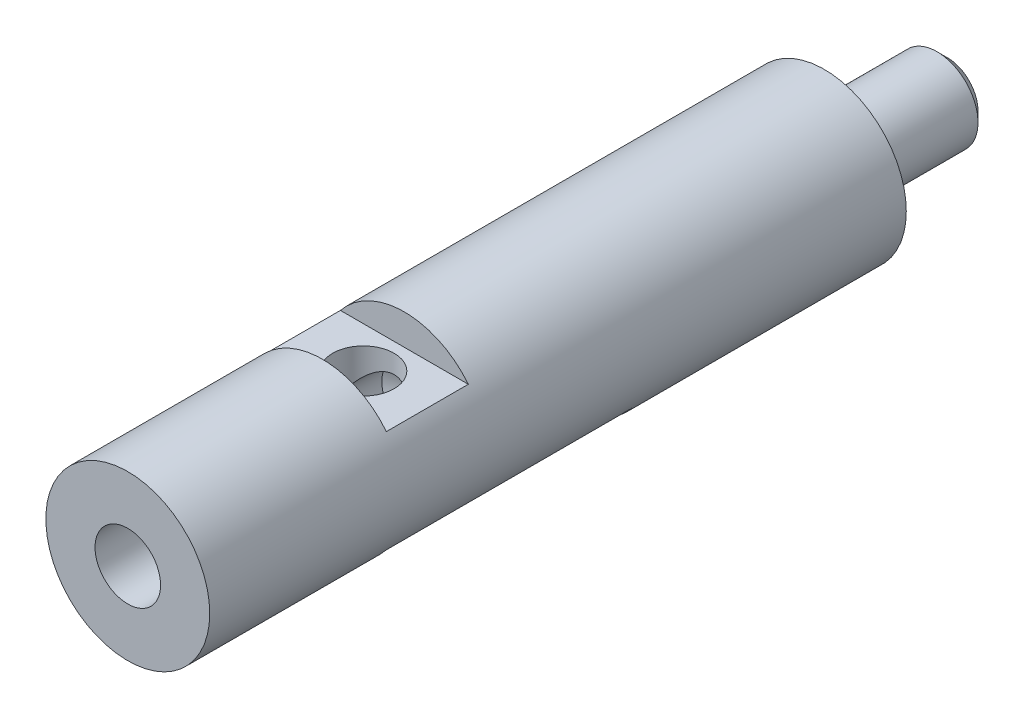
from build123d import *

# Parameters (mm, degrees)
SKETCH1_R                      = 4
BOSS_EXTRUDE2_DEPTH            = 34
SKETCH2_R                      = 2
BOSS_EXTRUDE3_DEPTH            = 6
CHAMFER1_SIZE                  = 0.5
F_3_2_3_2_DIAMETER_HOLE1_D     = 3.2
F_3_2_3_2_DIAMETER_HOLE1_DEPTH = 14
F_3_2_3_2_DIAMETER_HOLE1_TIP   = 0.96137699
CUT_EXTRUDE1_DEPTH             = 41.398019753
CUT_EXTRUDE1_DEPTH_BACK        = 41.398019753
SKETCH5_W                      = 12
SKETCH5_H                      = 1.5
SKETCH5_W_2                    = 4
F_3_0_3_DIAMETER_HOLE1_REACH   = 42.722
F_3_0_3_DIAMETER_HOLE1_BORE_R  = 1.5
SCALE1_SCALE                   = 1.5


with BuildPart() as part:
    # Sketch1 → Boss-Extrude2 (new body)
    with BuildSketch(Plane.XY):
        Circle(SKETCH1_R)
    extrude(amount=-BOSS_EXTRUDE2_DEPTH)

    # Sketch2 → Boss-Extrude3 (add)
    with BuildSketch(Plane(origin=(0, 0, -34), x_dir=(-1, 0, 0), z_dir=(0, 0, -1))):
        Circle(SKETCH2_R)
    extrude(amount=BOSS_EXTRUDE3_DEPTH)

    # Chamfer1
    chamfer1_edges = [part.edges().sort_by_distance(p)[0] for p in [
        (2, 0, -40),
    ]]
    chamfer(chamfer1_edges, length=CHAMFER1_SIZE)

    # Ø3.2 (3.2) Diameter Hole1
    with Locations(Plane.XY):
        with Locations((0, 0)):
            Hole(F_3_2_3_2_DIAMETER_HOLE1_D / 2, depth=F_3_2_3_2_DIAMETER_HOLE1_DEPTH)
            with Locations((0, 0, -(F_3_2_3_2_DIAMETER_HOLE1_DEPTH + F_3_2_3_2_DIAMETER_HOLE1_TIP / 2))):  # 118° drill point
                Cone(0, F_3_2_3_2_DIAMETER_HOLE1_D / 2, F_3_2_3_2_DIAMETER_HOLE1_TIP, mode=Mode.SUBTRACT)

    # Sketch5 → Cut-Extrude1 (cut, two sides: drawn at the far end of the back side and taken through both)
    with BuildSketch(Plane(origin=(0, 0, 0), x_dir=(0, 0, -1), z_dir=(1, 0, 0)).offset(-CUT_EXTRUDE1_DEPTH_BACK)):
        with Locations((15.5, -3.25)):
            Rectangle(SKETCH5_W, SKETCH5_H)
        with Locations((11.5, 3.25)):
            Rectangle(SKETCH5_W_2, SKETCH5_H)
    extrude(amount=CUT_EXTRUDE1_DEPTH + CUT_EXTRUDE1_DEPTH_BACK, mode=Mode.SUBTRACT)

    # Ø3.0 (3) Diameter Hole1 bore → Ø3.0 (3) Diameter Hole1 (cut, up to next)
    with BuildSketch(Plane(origin=(0, 2.5, 0), x_dir=(1, 0, 0), z_dir=(0, 1, 0)), mode=Mode.PRIVATE) as f_3_0_3_diameter_hole1_sk1:
        with Locations((0, 11.5)):
            Circle(F_3_0_3_DIAMETER_HOLE1_BORE_R)
    f_3_0_3_diameter_hole1_tool1 = extrude(f_3_0_3_diameter_hole1_sk1.sketch, amount=-F_3_0_3_DIAMETER_HOLE1_REACH, mode=Mode.PRIVATE) & part.part
    add(f_3_0_3_diameter_hole1_tool1.solids().sort_by_distance((0, 2.5, -11.5))[0], mode=Mode.SUBTRACT)


with BuildPart() as part_1:
    # Scale1: scaled about (4.68e-07, 0.094714404, -18.871986745)
    add(part.part.scale(SCALE1_SCALE).moved(Location((-2.34e-07, -0.047357202, 9.435993373))))


solid = part_1.part
